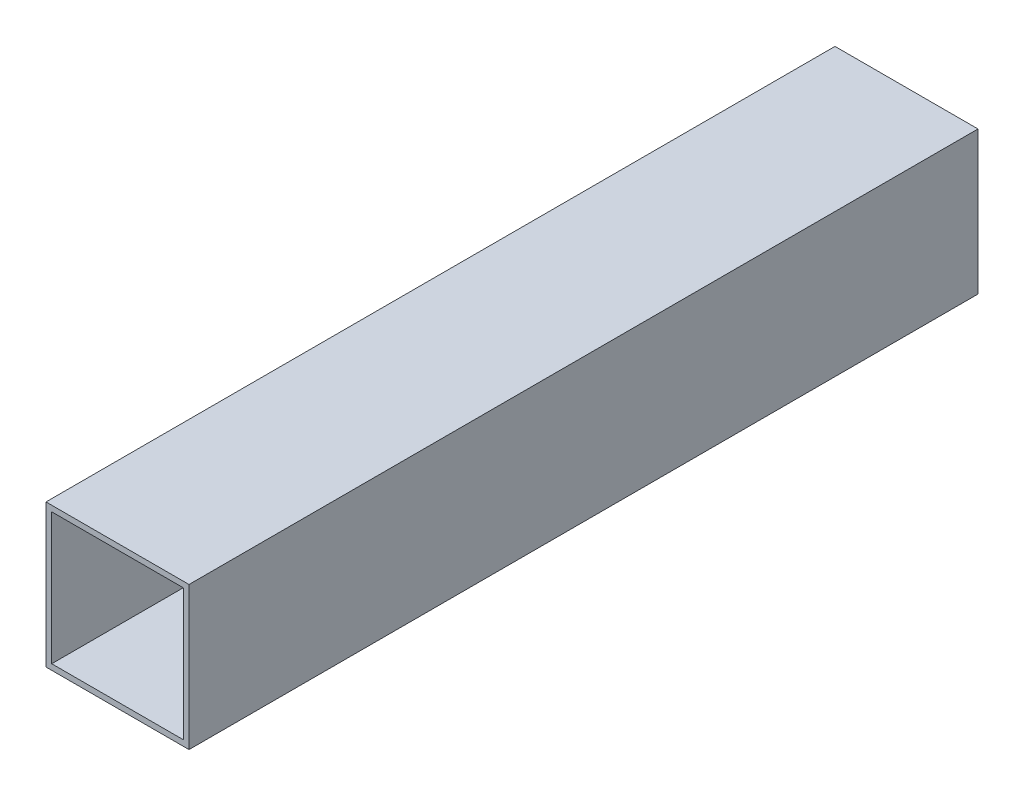
from build123d import *

# Parameters (mm, degrees)
SKETCH1_W           = 50
SKETCH1_H           = 50
SKETCH1_W_2         = 46
SKETCH1_H_2         = 46
BOSS_EXTRUDE1_DEPTH = 275.86


with BuildPart() as part:
    # Sketch1 → Boss-Extrude1 (new body)
    with BuildSketch(Plane.XY):
        Rectangle(SKETCH1_W, SKETCH1_H)
        Rectangle(SKETCH1_W_2, SKETCH1_H_2, mode=Mode.SUBTRACT)
    extrude(amount=BOSS_EXTRUDE1_DEPTH)


solid = part.part
